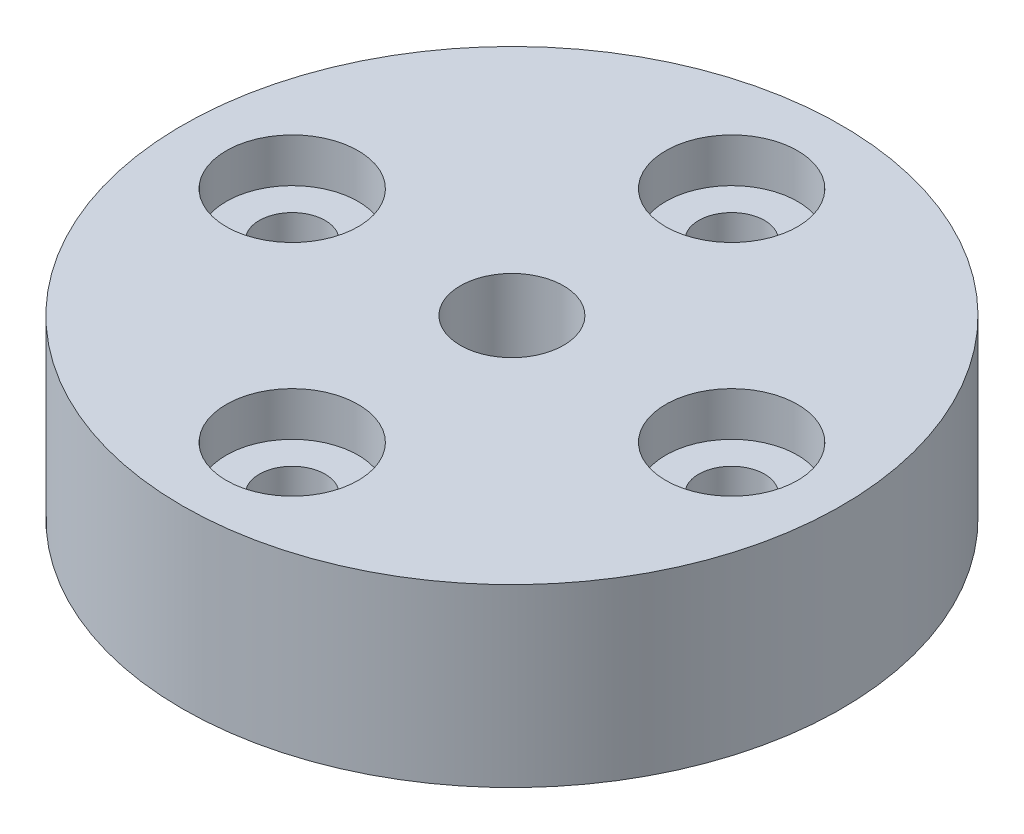
from build123d import *

# Parameters (mm, degrees)
SKETCH1_R           = 15
SKETCH1_R_2         = 1.5
BOSS_EXTRUDE1_DEPTH = 8
SKETCH2_R           = 2.35
CUT_EXTRUDE1_DEPTH  = 23.671568098
CUT_EXTRUDE2_START  = -2
SKETCH3_R           = 3
SKETCH3_R_2         = 1.5
CUT_EXTRUDE2_DEPTH  = 2
SKETCH4_R           = 3
CUT_EXTRUDE3_DEPTH  = 2


with BuildPart() as part:
    # Sketch1 → Boss-Extrude1 (new body)
    with BuildSketch(Plane(origin=(0, 0, 0), x_dir=(1, 0, 0), z_dir=(0, 1, 0))):
        with Locations(Location((0, 0, 0), (0, 0, 270))):
            Circle(SKETCH1_R)
        with Locations(Location((0, 10, 0), (0, 0, 270))):
            Circle(SKETCH1_R_2, mode=Mode.SUBTRACT)
        with Locations(Location((10, 0, 0), (0, 0, 270))):
            Circle(SKETCH1_R_2, mode=Mode.SUBTRACT)
        with Locations(Location((0, -10, 0), (0, 0, 270))):
            Circle(SKETCH1_R_2, mode=Mode.SUBTRACT)
        with Locations(Location((-10, 0, 0), (0, 0, 270))):
            Circle(SKETCH1_R_2, mode=Mode.SUBTRACT)
    extrude(amount=BOSS_EXTRUDE1_DEPTH)

    # Sketch2 → Cut-Extrude1 (cut, through all)
    with BuildSketch(Plane(origin=(0, 8, 0), x_dir=(1, 0, 0), z_dir=(0, 1, 0))):
        with Locations(Location((0, 0, 0), (0, 0, 270))):
            Circle(SKETCH2_R)
    extrude(amount=-CUT_EXTRUDE1_DEPTH, mode=Mode.SUBTRACT)

    # Sketch3 → Cut-Extrude2 (cut)
    # profile 1 of 4: a face of its own
    with BuildSketch(Plane(origin=(0, 8, 0), x_dir=(1, 0, 0), z_dir=(0, 1, 0)).offset(CUT_EXTRUDE2_START)):
        with Locations(Location((-10, 0, 0), (0, 0, 270))):
            Circle(SKETCH3_R)
        with Locations(Location((-10, 0, 0), (0, 0, 270))):
            Circle(SKETCH3_R_2, mode=Mode.SUBTRACT)
    # profile 2 of 4: a face of its own
    with BuildSketch(Plane(origin=(0, 8, 0), x_dir=(1, 0, 0), z_dir=(0, 1, 0)).offset(CUT_EXTRUDE2_START)):
        with Locations(Location((0, -10, 0), (0, 0, 270))):
            Circle(SKETCH3_R)
        with Locations(Location((0, -10, 0), (0, 0, 270))):
            Circle(SKETCH3_R_2, mode=Mode.SUBTRACT)
    # profile 3 of 4: a face of its own
    with BuildSketch(Plane(origin=(0, 8, 0), x_dir=(1, 0, 0), z_dir=(0, 1, 0)).offset(CUT_EXTRUDE2_START)):
        with Locations(Location((10, 0, 0), (0, 0, 270))):
            Circle(SKETCH3_R)
        with Locations(Location((10, 0, 0), (0, 0, 270))):
            Circle(SKETCH3_R_2, mode=Mode.SUBTRACT)
    # profile 4 of 4: a face of its own
    with BuildSketch(Plane(origin=(0, 8, 0), x_dir=(1, 0, 0), z_dir=(0, 1, 0)).offset(CUT_EXTRUDE2_START)):
        with Locations(Location((0, 10, 0), (0, 0, 270))):
            Circle(SKETCH3_R)
    extrude(amount=CUT_EXTRUDE2_DEPTH, mode=Mode.SUBTRACT)

    # Sketch4 → Cut-Extrude3 (cut)
    with BuildSketch(Plane.XZ):
        with Locations(Location((0, 10, 0), (0, 0, 90))):
            Circle(SKETCH4_R)
        with Locations(Location((10, 0, 0), (0, 0, 90))):
            Circle(SKETCH4_R)
        with Locations(Location((0, -10, 0), (0, 0, 90))):
            Circle(SKETCH4_R)
        with Locations(Location((-10, 0, 0), (0, 0, 90))):
            Circle(SKETCH4_R)
    extrude(amount=-CUT_EXTRUDE3_DEPTH, mode=Mode.SUBTRACT)


solid = part.part
